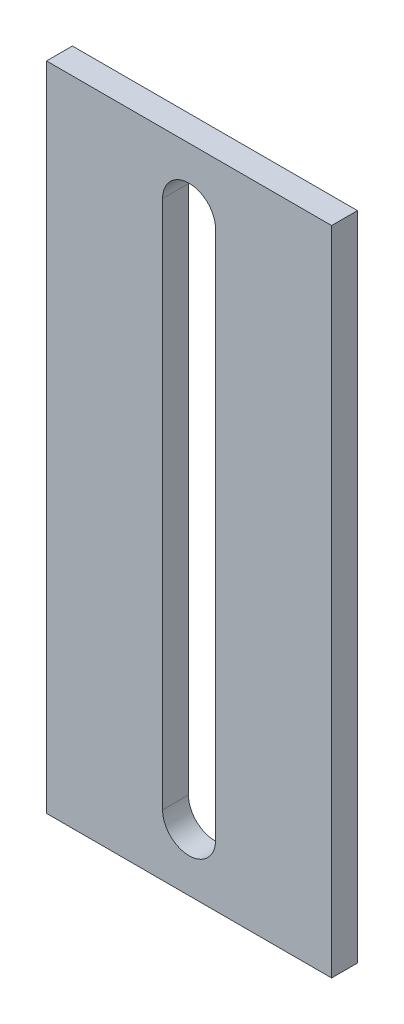
from build123d import *

# Parameters (mm, degrees)
CROQUIS1_W              = 70
CROQUIS1_H              = 160
SALIENTE_EXTRUIR1_DEPTH = 6.35


with BuildPart() as part:
    # Croquis1 → Saliente-Extruir1 (new body)
    with BuildSketch(Plane.XY):
        Rectangle(CROQUIS1_W, CROQUIS1_H)
        with BuildLine():
            Line((-6.5, -65), (-6.5, 65))
            ThreePointArc((-6.5, 65), (0, 71.5), (6.5, 65))
            Line((6.5, 65), (6.5, -65))
            ThreePointArc((6.5, -65), (0, -71.5), (-6.5, -65))
        make_face(mode=Mode.SUBTRACT)
    extrude(amount=SALIENTE_EXTRUIR1_DEPTH)


solid = part.part
